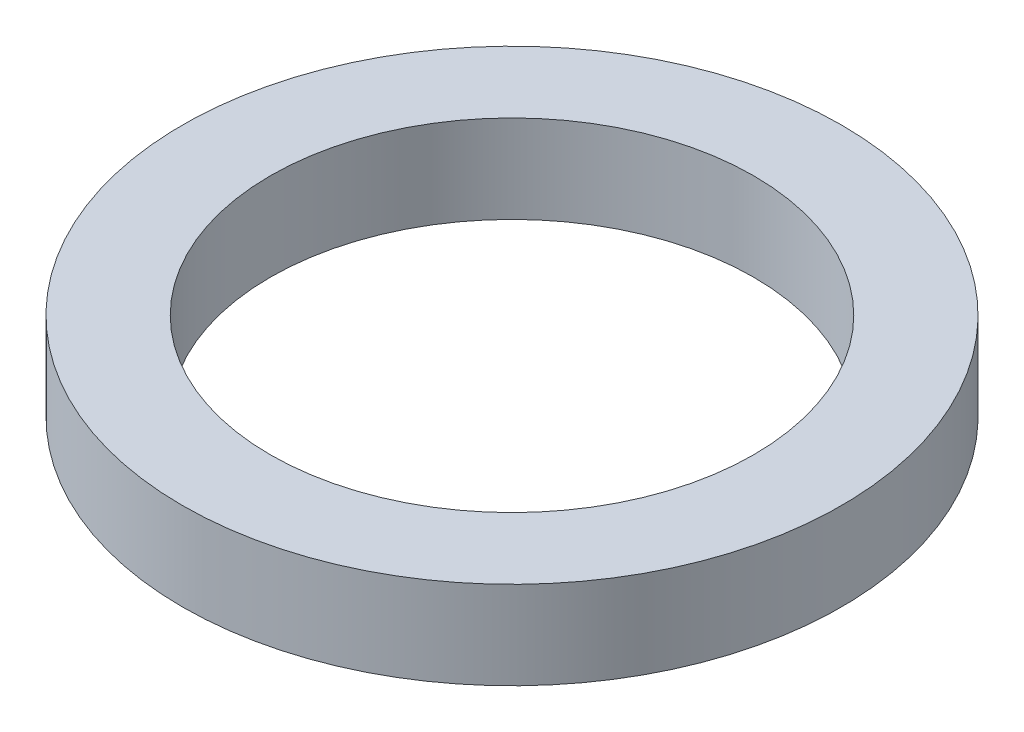
from build123d import *

# Parameters (mm, degrees)
SKETCH_1_R      = 7.5
SKETCH_1_R_2    = 5.5
EXTRUDE_1_DEPTH = 2


with BuildPart() as part:
    # 草图1 → 凸台-拉伸1 (new body)
    with BuildSketch(Plane(origin=(0, 0, 0), x_dir=(1, 0, 0), z_dir=(0, 1, 0))):
        with Locations(Location((0, 0, 0), (0, 0, 270))):
            Circle(SKETCH_1_R)
        with Locations(Location((0, 0, 0), (0, 0, 270))):
            Circle(SKETCH_1_R_2, mode=Mode.SUBTRACT)
    extrude(amount=EXTRUDE_1_DEPTH)


solid = part.part
